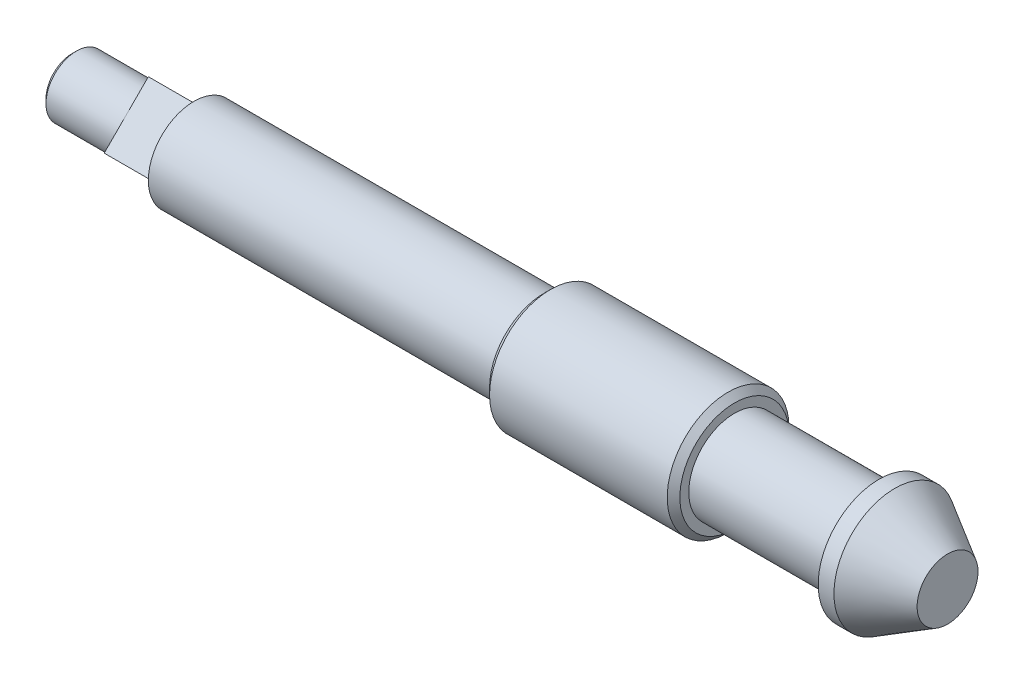
from build123d import *

# Parameters (mm, degrees)
CHAMFER_1_SIZE      = 0.828
SKETCH_2_R          = 6
SKETCH_2_R_2        = 4
CUT_EXTRUDE_1_DEPTH = 10
SKETCH_3_R          = 6
CUT_EXTRUDE_2_DEPTH = 6
CHAMFER_2_SIZE      = 0.5545


with BuildPart() as part:
    # Эскиз1 → Повернуть1 (revolve)
    with BuildSketch(Plane.XY, mode=Mode.PRIVATE) as revolve_1_sk:
        Polygon((0, 0), (0, 4), (-6.92820323, 8), (-9, 8), (-9, 6), (-28, 6), (-28, 8), (-53, 8), (-53, 6), (-115, 6), (-115, 0), align=None)
    revolve(revolve_1_sk.sketch.rotate(Axis((0, 0, 0), (-1, 0, 0)), 90), axis=Axis((0, 0, 0), (-1, 0, 0)))

    # Фаска1
    chamfer_1_edges = [part.edges().sort_by_distance(p)[0] for p in [
        (-53, 0, 8),
        (-28, 0, 8),
    ]]
    chamfer(chamfer_1_edges, length=CHAMFER_1_SIZE)

    # Эскиз2 → Вырез-Вытянуть1 (cut)
    with BuildSketch(Plane.ZY.offset(115)):
        with Locations(Location((0, 0, 0), (0, 0, 180))):
            Circle(SKETCH_2_R)
        Circle(SKETCH_2_R_2, mode=Mode.SUBTRACT)
    extrude(amount=-CUT_EXTRUDE_1_DEPTH, mode=Mode.SUBTRACT)

    # Эскиз3 → Вырез-Вытянуть2 (cut)
    with BuildSketch(Plane.ZY.offset(105)):
        with Locations(Location((0, 0, 0), (0, 0, 180))):
            Circle(SKETCH_3_R)
        Polygon((0, 5.798275606), (-5.798275606, 0), (0, -5.798275606), (5.798275606, 0), align=None, mode=Mode.SUBTRACT)
    extrude(amount=-CUT_EXTRUDE_2_DEPTH, mode=Mode.SUBTRACT)

    # Фаска2
    chamfer_2_edges = [part.edges().sort_by_distance(p)[0] for p in [
        (-115, 0, -4),
    ]]
    chamfer(chamfer_2_edges, length=CHAMFER_2_SIZE)


solid = part.part
